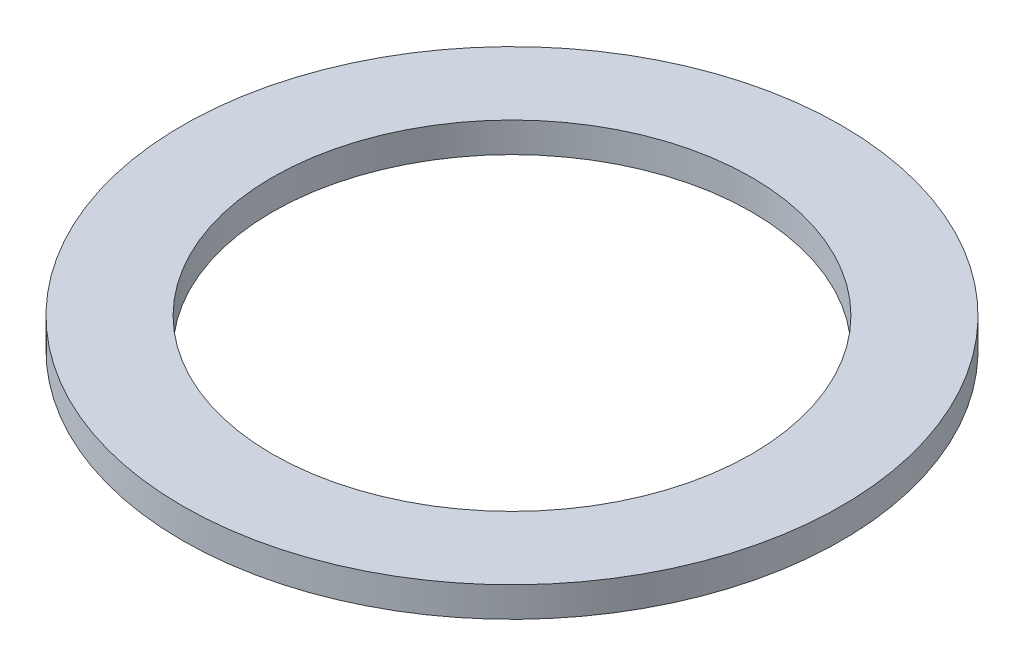
from build123d import *

# Parameters (mm, degrees)
SKETCH1_R           = 11
BOSS_EXTRUDE1_DEPTH = 1
SKETCH5_R           = 8
CUT_EXTRUDE1_DEPTH  = 16.588457268


with BuildPart() as part:
    # Sketch1 → Boss-Extrude1 (new body)
    with BuildSketch(Plane(origin=(0, 0, 0), x_dir=(1, 0, 0), z_dir=(0, 1, 0))):
        with Locations(Location((0, 0, 0), (0, 0, 270))):
            Circle(SKETCH1_R)
    extrude(amount=BOSS_EXTRUDE1_DEPTH)

    # Sketch5 → Cut-Extrude1 (cut, through all)
    with BuildSketch(Plane(origin=(0, 1, 0), x_dir=(-1, 0, 0), z_dir=(0, 1, 0))):
        with Locations(Location((0, 0, 0), (0, 0, 90))):
            Circle(SKETCH5_R)
    extrude(amount=-CUT_EXTRUDE1_DEPTH, mode=Mode.SUBTRACT)


solid = part.part
